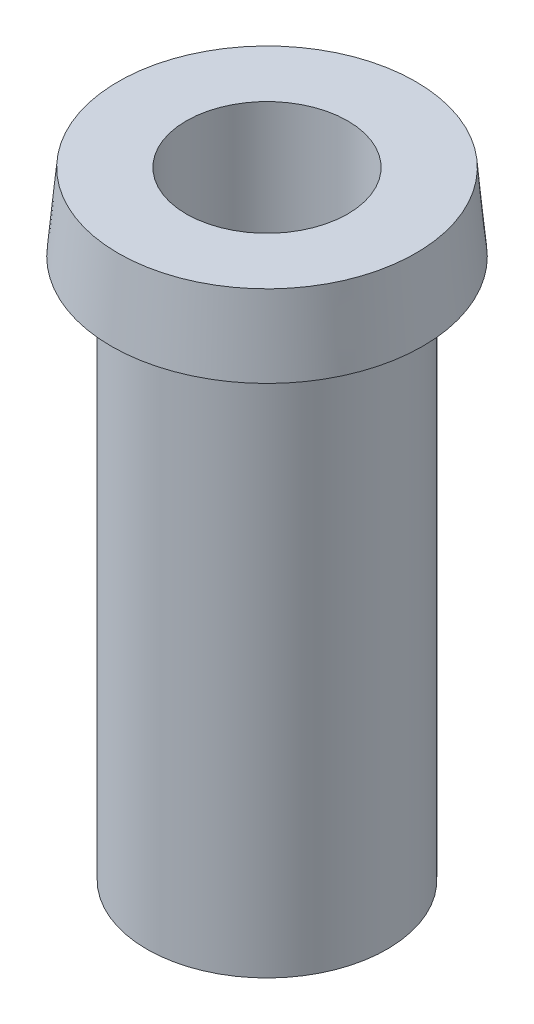
from build123d import *

# Parameters (mm, degrees)
SKETCH1_R           = 6.5024
BOSS_EXTRUDE1_DEPTH = 33.401
SKETCH2_R           = 4.3688
CUT_EXTRUDE1_DEPTH  = 33.401


with BuildPart() as part:
    # Sketch1 → Boss-Extrude1 (new body)
    with BuildSketch(Plane(origin=(0, 0, 0), x_dir=(1, 0, 0), z_dir=(0, 1, 0))):
        with Locations(Location((0, 0, 0), (0, 0, 270))):
            Circle(SKETCH1_R)
    extrude(amount=BOSS_EXTRUDE1_DEPTH)

    # Sketch2 → Cut-Extrude1 (cut)
    with BuildSketch(Plane(origin=(0, 0, 0), x_dir=(1, 0, 0), z_dir=(0, 1, 0))):
        with Locations(Location((0, 0, 0), (0, 0, 270))):
            Circle(SKETCH2_R)
    extrude(amount=CUT_EXTRUDE1_DEPTH, mode=Mode.SUBTRACT)

    # Sketch3 → Revolve2 (revolve)
    with BuildSketch(Plane.XY, mode=Mode.PRIVATE) as revolve2_sk:
        Polygon((6.5024, 33.401), (8.0518, 33.401), (8.4328, 29.2354), (6.5024, 29.2354), align=None)
    revolve(revolve2_sk.sketch.rotate(Axis((0, 33.401, 0), (0, -1, 0)), 90), axis=Axis((0, 33.401, 0), (0, -1, 0)))


solid = part.part
